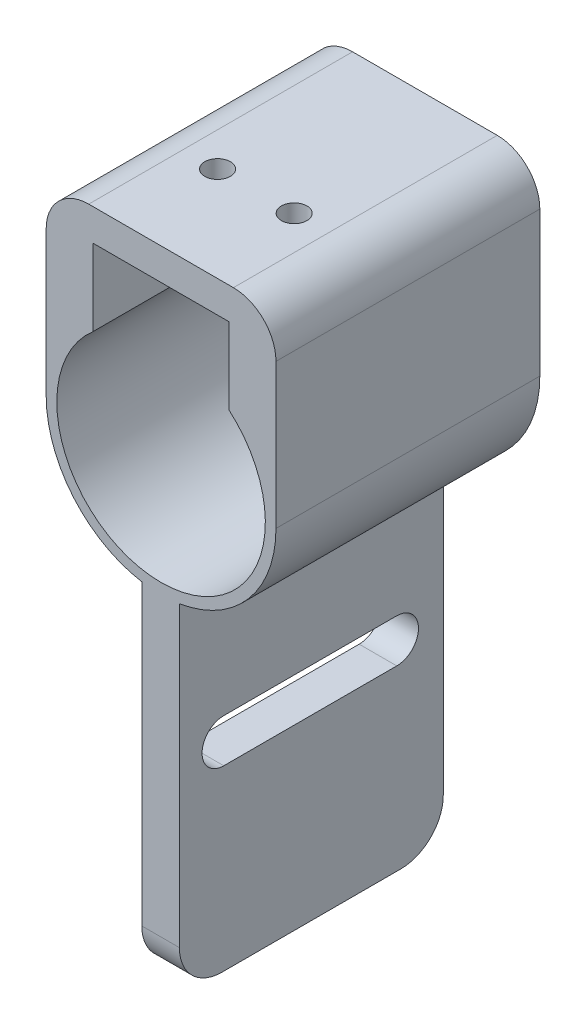
from build123d import *

# Parameters (mm, degrees)
SKETCH1_R           = 12.25
BOSS_EXTRUDE2_DEPTH = 31
SKETCH2_W           = 16
SKETCH2_H           = 9
CUT_EXTRUDE1_DEPTH  = 15
SKETCH3_R           = 1.5
CUT_EXTRUDE2_DEPTH  = 15
CUT_EXTRUDE3_DEPTH  = 15
FILLET1_R           = 5


with BuildPart() as part:
    # Sketch1 → Boss-Extrude2 (new body)
    with BuildSketch(Plane.XY):
        with BuildLine():
            Line((-13.5, 0), (-13.5, 22))
            Line((-13.5, 22), (13.5, 22))
            Line((13.5, 22), (13.5, 0))
            ThreePointArc((13.5, 0), (10.279789156, -8.750767675), (2.155417052, -13.326821727))
            Line((2.155417052, -13.326821727), (2.155417052, -53.326821727))
            Line((2.155417052, -53.326821727), (-2.26470283, -53.326821727))
            Line((-2.26470283, -53.326821727), (-2.26470283, -13.308685927))
            ThreePointArc((-2.26470283, -13.308685927), (-10.315606822, -8.708516286), (-13.5, 0))
        make_face()
        Circle(SKETCH1_R, mode=Mode.SUBTRACT)
    extrude(amount=BOSS_EXTRUDE2_DEPTH)

    # Sketch2 → Cut-Extrude1 (cut)
    with BuildSketch(Plane.XY.offset(31)):
        with Locations((0, 13.776987658)):
            Rectangle(SKETCH2_W, SKETCH2_H)
    extrude(amount=-CUT_EXTRUDE1_DEPTH, mode=Mode.SUBTRACT)

    # Sketch3 → Cut-Extrude2 (cut)
    with BuildSketch(Plane.XZ.offset(-18.276987658)):
        with Locations(Location((-4.5, 19.859972316, 0), (0, 0, 270))):
            Circle(SKETCH3_R)
        with Locations(Location((4.5, 19.859972316, 0), (0, 0, 270))):
            Circle(SKETCH3_R)
    extrude(amount=-CUT_EXTRUDE2_DEPTH, mode=Mode.SUBTRACT)

    # Sketch4 → Cut-Extrude3 (cut)
    with BuildSketch(Plane(origin=(2.155417052, 0, 0), x_dir=(0, 0, -1), z_dir=(1, 0, 0))):
        with BuildLine():
            Line((-25.787321286, -27.326821727), (-5.462583223, -27.326821727))
            ThreePointArc((-5.462583223, -27.326821727), (-2.912583223, -29.876821727), (-5.462583223, -32.426821727))
            Line((-5.462583223, -32.426821727), (-25.787321286, -32.426821727))
            ThreePointArc((-25.787321286, -32.426821727), (-28.337321286, -29.876821727), (-25.787321286, -27.326821727))
        make_face()
    extrude(amount=-CUT_EXTRUDE3_DEPTH, mode=Mode.SUBTRACT)

    # Fillet1
    fillet1_edges = [part.edges().sort_by_distance(p)[0] for p in [
        (-0.054642889, -53.326821727, 0),
        (-0.054642889, -53.326821727, 31),
        (-13.5, 22, 15.5),
        (13.5, 22, 15.5),
    ]]
    fillet(fillet1_edges, radius=FILLET1_R)


solid = part.part
